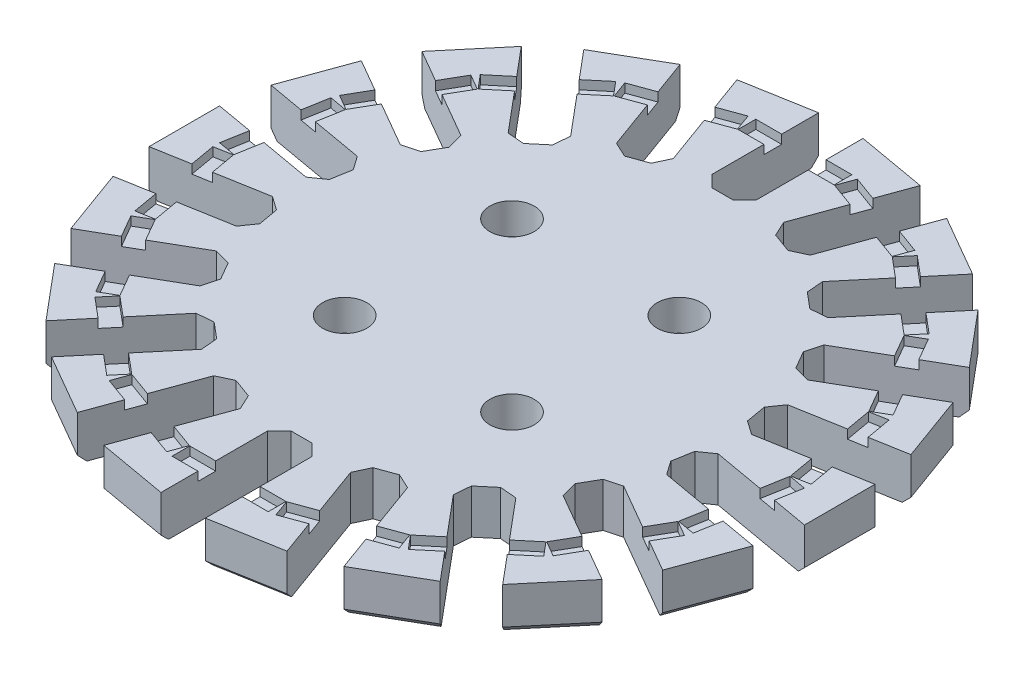
from build123d import *

# Parameters (mm, degrees)
BOSS_EXTRUDE1_DEPTH = 3
CHAMFER1_SIZE       = 0.8
CHAMFER2_SIZE       = 0.5
SKETCH4_R           = 1.5
CUT_EXTRUDE4_DEPTH  = 3
SKETCH9_R           = 11
CUT_EXTRUDE8_DEPTH  = 0.9
SKETCH2_W           = 6.5
SKETCH2_H           = 1.2
CUT_EXTRUDE9_DEPTH  = 0.6


with BuildPart() as part:
    # Sketch1 → Boss-Extrude1 (new body)
    with BuildSketch(Plane(origin=(0, 0, 0), x_dir=(1, 0, 0), z_dir=(0, 1, 0))):
        Polygon((-1.5, 22.235509529), (-1.5, 14.235509529), (1.5, 14.235509529), (1.5, 22.235509529), (6.195453225, 21.407574439), (3.459292078, 13.890033472), (6.278369941, 12.863973042), (9.014531087, 20.381514009), (13.143643356, 17.997569929), (8.001342478, 11.869214384), (10.299475807, 9.940851555), (15.441776685, 16.0692071), (18.506516118, 12.41679287), (11.578312888, 8.41679287), (13.078312888, 5.818716659), (20.006516118, 9.818716659), (21.63722991, 5.338367339), (13.758767886, 3.949181917), (14.279712419, 0.994758658), (22.158174443, 2.38394408), (22.158174443, -2.38394408), (14.279712419, -0.994758658), (13.758767886, -3.949181917), (21.63722991, -5.338367339), (20.006516118, -9.818716659), (13.078312888, -5.818716659), (11.578312888, -8.41679287), (18.506516118, -12.41679287), (15.441776685, -16.0692071), (10.299475807, -9.940851555), (8.001342478, -11.869214384), (13.143643356, -17.997569929), (9.014531087, -20.381514009), (6.278369941, -12.863973042), (3.459292078, -13.890033472), (6.195453225, -21.407574439), (1.5, -22.235509529), (1.5, -14.235509529), (-1.5, -14.235509529), (-1.5, -22.235509529), (-6.195453225, -21.407574439), (-3.459292078, -13.890033472), (-6.278369941, -12.863973042), (-9.014531087, -20.381514009), (-13.143643356, -17.997569929), (-8.001342478, -11.869214384), (-10.299475807, -9.940851555), (-15.441776685, -16.0692071), (-18.506516118, -12.41679287), (-11.578312888, -8.41679287), (-13.078312888, -5.818716659), (-20.006516118, -9.818716659), (-21.63722991, -5.338367339), (-13.758767886, -3.949181917), (-14.279712419, -0.994758658), (-22.158174443, -2.38394408), (-22.158174443, 2.38394408), (-14.279712419, 0.994758658), (-13.758767886, 3.949181917), (-21.63722991, 5.338367339), (-20.006516118, 9.818716659), (-13.078312888, 5.818716659), (-11.578312888, 8.41679287), (-18.506516118, 12.41679287), (-15.441776685, 16.0692071), (-10.299475807, 9.940851555), (-8.001342478, 11.869214384), (-13.143643356, 17.997569929), (-9.014531087, 20.381514009), (-6.278369941, 12.863973042), (-3.459292078, 13.890033472), (-6.195453225, 21.407574439), align=None)
    extrude(amount=BOSS_EXTRUDE1_DEPTH)

    # Chamfer1
    chamfer1_edges = [part.edges().sort_by_distance(p)[0] for p in [
        (-1.5, 1.5, -14.235509529),
        (1.5, 1.5, -14.235509529),
        (3.459292078, 1.5, -13.890033472),
        (6.278369941, 1.5, -12.863973042),
        (8.001342478, 1.5, -11.869214384),
        (10.299475807, 1.5, -9.940851555),
        (11.578312888, 1.5, -8.41679287),
        (13.078312888, 1.5, -5.818716659),
        (13.758767886, 1.5, -3.949181917),
        (14.279712419, 1.5, -0.994758658),
        (14.279712419, 1.5, 0.994758658),
        (13.758767886, 1.5, 3.949181917),
        (13.078312888, 1.5, 5.818716659),
        (11.578312888, 1.5, 8.41679287),
        (10.299475807, 1.5, 9.940851555),
        (8.001342478, 1.5, 11.869214384),
        (6.278369941, 1.5, 12.863973042),
        (3.459292078, 1.5, 13.890033472),
        (1.5, 1.5, 14.235509529),
        (-1.5, 1.5, 14.235509529),
        (-3.459292078, 1.5, 13.890033472),
        (-6.278369941, 1.5, 12.863973042),
        (-8.001342478, 1.5, 11.869214384),
        (-10.299475807, 1.5, 9.940851555),
        (-11.578312888, 1.5, 8.41679287),
        (-13.078312888, 1.5, 5.818716659),
        (-13.758767886, 1.5, 3.949181917),
        (-14.279712419, 1.5, 0.994758658),
        (-14.279712419, 1.5, -0.994758658),
        (-13.758767886, 1.5, -3.949181917),
        (-13.078312888, 1.5, -5.818716659),
        (-11.578312888, 1.5, -8.41679287),
        (-10.299475807, 1.5, -9.940851555),
        (-8.001342478, 1.5, -11.869214384),
        (-6.278369941, 1.5, -12.863973042),
        (-3.459292078, 1.5, -13.890033472),
    ]]
    chamfer(chamfer1_edges, length=CHAMFER1_SIZE)

    # Chamfer2
    chamfer2_edges = [part.edges().sort_by_distance(p)[0] for p in [
        (3.847726612, 0, -21.821541984),
        (11.079087221, 0, -19.189541969),
        (16.974146402, 0, -14.242999985),
        (20.821873014, 0, -7.578541999),
        (22.158174443, 0, 0),
        (20.821873014, 0, 7.578541999),
        (16.974146402, 0, 14.242999985),
        (11.079087221, 0, 19.189541969),
        (3.847726612, 0, 21.821541984),
        (-3.847726612, 0, 21.821541984),
        (-11.079087221, 0, 19.189541969),
        (-16.974146402, 0, 14.242999985),
        (-20.821873014, 0, 7.578541999),
        (-22.158174443, 0, 0),
        (-20.821873014, 0, -7.578541999),
        (-16.974146402, 0, -14.242999985),
        (-11.079087221, 0, -19.189541969),
        (-3.847726612, 0, -21.821541984),
    ]]
    chamfer(chamfer2_edges, length=CHAMFER2_SIZE)

    # Sketch4 → Cut-Extrude4 (cut)
    with BuildSketch(Plane.XZ):
        with Locations(Location((-5.656854249, 5.656854249, 0), (0, 0, 270))):
            Circle(SKETCH4_R)
        with Locations(Location((5.656854249, 5.656854249, 0), (0, 0, 270))):
            Circle(SKETCH4_R)
        with Locations(Location((5.656854249, -5.656854249, 0), (0, 0, 270))):
            Circle(SKETCH4_R)
        with Locations(Location((-5.656854249, -5.656854249, 0), (0, 0, 270))):
            Circle(SKETCH4_R)
    extrude(amount=-CUT_EXTRUDE4_DEPTH, mode=Mode.SUBTRACT)

    # Sketch9 → Cut-Extrude8 (cut)
    with BuildSketch(Plane.XZ):
        with Locations(Location((0, 0, 0), (0, 0, 270))):
            Circle(SKETCH9_R)
    extrude(amount=-CUT_EXTRUDE8_DEPTH, mode=Mode.SUBTRACT)

    # Sketch2 → Cut-Extrude9 (cut)
    with BuildSketch(Plane(origin=(0, 3, 0), x_dir=(1, 0, 0), z_dir=(0, 1, 0))):
        with Locations((0, 19.135509529)):
            Rectangle(SKETCH2_W, SKETCH2_H)
        Polygon((3.285516608, 18.529246993), (3.69594078, 19.656878138), (9.803942815, 17.433747206), (9.393518643, 16.306116061), align=None)
        Polygon((9.424751424, 16.288083807), (10.196096556, 17.207337138), (15.175385436, 13.029217675), (14.404040305, 12.109964344), align=None)
        Polygon((14.427222124, 12.082337327), (15.466452609, 12.682337327), (18.716452609, 7.053172202), (17.677222124, 6.453172202), align=None)
        Polygon((17.689556913, 6.419282649), (18.871326216, 6.627660462), (20.000039371, 0.226410068), (18.818270068, 0.018032255), align=None)
        Polygon((18.818270068, -0.018032255), (20.000039371, -0.226410068), (18.871326216, -6.627660462), (17.689556913, -6.419282649), align=None)
        Polygon((17.677222124, -6.453172202), (18.716452609, -7.053172202), (15.466452609, -12.682337327), (14.427222124, -12.082337327), align=None)
        Polygon((14.404040305, -12.109964344), (15.175385436, -13.029217675), (10.196096556, -17.207337138), (9.424751424, -16.288083807), align=None)
        Polygon((9.393518643, -16.306116061), (9.803942815, -17.433747206), (3.69594078, -19.656878138), (3.285516608, -18.529246993), align=None)
        with Locations((0, -19.135509529)):
            Rectangle(SKETCH2_W, SKETCH2_H)
        Polygon((-3.285516608, -18.529246993), (-3.69594078, -19.656878138), (-9.803942815, -17.433747206), (-9.393518643, -16.306116061), align=None)
        Polygon((-9.424751424, -16.288083807), (-10.196096556, -17.207337138), (-15.175385436, -13.029217675), (-14.404040305, -12.109964344), align=None)
        Polygon((-14.427222124, -12.082337327), (-15.466452609, -12.682337327), (-18.716452609, -7.053172202), (-17.677222124, -6.453172202), align=None)
        Polygon((-17.689556913, -6.419282649), (-18.871326216, -6.627660462), (-20.000039371, -0.226410068), (-18.818270068, -0.018032255), align=None)
        Polygon((-18.818270068, 0.018032255), (-20.000039371, 0.226410068), (-18.871326216, 6.627660462), (-17.689556913, 6.419282649), align=None)
        Polygon((-17.677222124, 6.453172202), (-18.716452609, 7.053172202), (-15.466452609, 12.682337327), (-14.427222124, 12.082337327), align=None)
        Polygon((-14.404040305, 12.109964344), (-15.175385436, 13.029217675), (-10.196096556, 17.207337138), (-9.424751424, 16.288083807), align=None)
        Polygon((-9.393518643, 16.306116061), (-9.803942815, 17.433747206), (-3.69594078, 19.656878138), (-3.285516608, 18.529246993), align=None)
    extrude(amount=-CUT_EXTRUDE9_DEPTH, mode=Mode.SUBTRACT)


solid = part.part
